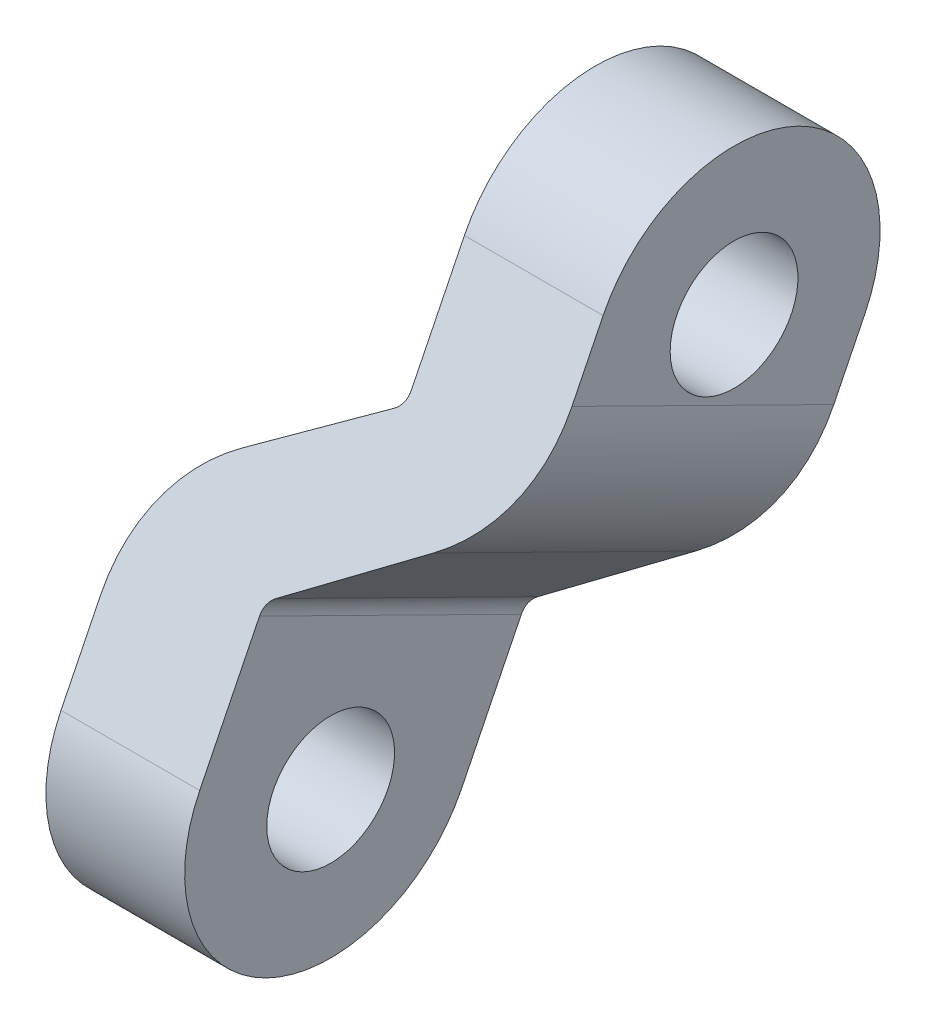
from build123d import *

# Parameters (mm, degrees)
BOSS_EXTRUDE1_DEPTH = 9.3
CUT_EXTRUDE1_DEPTH  = 42.511134509
CUT_EXTRUDE2_DEPTH  = 42.511134509
HOLE1_D             = 3.5
HOLE2_D             = 3.5
FILLET1_R           = 0.6
FILLET2_R           = 5


with BuildPart() as part:
    # Sketch1 → Boss-Extrude1 (new body)
    with BuildSketch(Plane(origin=(-27.480838388, 0, 0), x_dir=(0, 0, -1), z_dir=(1, 0, 0))):
        with BuildLine():
            Line((81.963336874, -40.96995038), (76.413336874, -52.210980091))
            ThreePointArc((76.413336874, -52.210980091), (78.229167535, -57.568475682), (83.586663126, -55.752645021))
            Line((83.586663126, -55.752645021), (89.136663126, -44.51161531))
            ThreePointArc((89.136663126, -44.51161531), (87.320832465, -39.154119719), (81.963336874, -40.96995038))
        make_face()
    extrude(amount=-BOSS_EXTRUDE1_DEPTH)

    # Sketch2 → Cut-Extrude1 (cut, through all)
    with BuildSketch(Plane(origin=(0, -44.107651135, -89.336111151), x_dir=(-1, 0, 0), z_dir=(0, -0.4427081162196108, -0.8966657815670697))):
        Polygon((31.280838388, 3.94822391), (31.280838388, -4.049700743), (36.780838388, -7.974283766), (36.780838388, 3.94822391), align=None)
    extrude(amount=-CUT_EXTRUDE1_DEPTH, mode=Mode.SUBTRACT)

    # Sketch3 → Cut-Extrude2 (cut, through all)
    with BuildSketch(Plane(origin=(0, -44.107651135, -89.336111151), x_dir=(-1, 0, 0), z_dir=(0, -0.4427081162196108, -0.8966657815670697))):
        Polygon((32.980838388, -17.88847919), (32.980838388, -8.986994848), (27.480838388, -4.88847919), (27.480838388, -17.88847919), align=None)
    extrude(amount=-CUT_EXTRUDE2_DEPTH, mode=Mode.SUBTRACT)

    # Hole1 (through all)
    with Locations(Plane.ZY.offset(36.780838388)):
        with Locations((-80, -53.981812556)):
            Hole(HOLE1_D / 2)

    # Hole2 (through all)
    with Locations(Plane.ZY.offset(31.280838388)):
        with Locations((-85.55, -42.740782845)):
            Hole(HOLE2_D / 2)

    # Fillet1
    fillet1_edges = [part.edges().sort_by_distance(p)[0] for p in [
        (-31.280838388, -45.968046752, -83.956612638),
        (-32.980838388, -50.395149429, -81.770832465),
    ]]
    fillet(fillet1_edges, radius=FILLET1_R)

    # Fillet2
    fillet2_edges = [part.edges().sort_by_distance(p)[0] for p in [
        (-36.780838388, -49.487086055, -82.21916788),
        (-27.480838388, -46.720150684, -83.585278611),
    ]]
    fillet(fillet2_edges, radius=FILLET2_R)


solid = part.part
